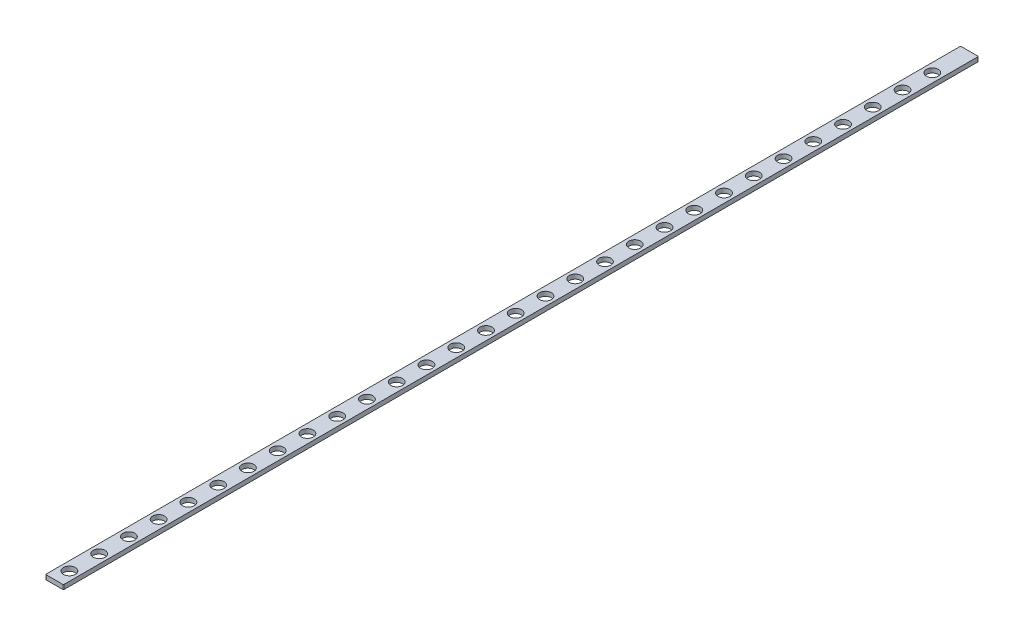
from build123d import *

# Parameters (mm, degrees)
SKETCH_1_W      = 12
SKETCH_1_H      = 615
SKETCH_1_R      = 4
EXTRUDE_1_DEPTH = 3
FILLET_1_R      = 0.5


with BuildPart() as part:
    # 草图1 → 凸台-拉伸1 (new body)
    with BuildSketch(Plane(origin=(0, 0, 0), x_dir=(1, 0, 0), z_dir=(0, 1, 0))):
        Rectangle(SKETCH_1_W, SKETCH_1_H)
        with Locations(Location((0, -297.5, 0), (0, 0, 270))):
            Circle(SKETCH_1_R, mode=Mode.SUBTRACT)
        with Locations(Location((0, -277.5, 0), (0, 0, 270))):
            Circle(SKETCH_1_R, mode=Mode.SUBTRACT)
        with Locations(Location((0, -257.5, 0), (0, 0, 270))):
            Circle(SKETCH_1_R, mode=Mode.SUBTRACT)
        with Locations(Location((0, -237.5, 0), (0, 0, 270))):
            Circle(SKETCH_1_R, mode=Mode.SUBTRACT)
        with Locations(Location((0, -217.5, 0), (0, 0, 270))):
            Circle(SKETCH_1_R, mode=Mode.SUBTRACT)
        with Locations(Location((0, -197.5, 0), (0, 0, 270))):
            Circle(SKETCH_1_R, mode=Mode.SUBTRACT)
        with Locations(Location((0, -177.5, 0), (0, 0, 270))):
            Circle(SKETCH_1_R, mode=Mode.SUBTRACT)
        with Locations(Location((0, -157.5, 0), (0, 0, 270))):
            Circle(SKETCH_1_R, mode=Mode.SUBTRACT)
        with Locations(Location((0, -137.5, 0), (0, 0, 270))):
            Circle(SKETCH_1_R, mode=Mode.SUBTRACT)
        with Locations(Location((0, -117.5, 0), (0, 0, 270))):
            Circle(SKETCH_1_R, mode=Mode.SUBTRACT)
        with Locations(Location((0, -97.5, 0), (0, 0, 270))):
            Circle(SKETCH_1_R, mode=Mode.SUBTRACT)
        with Locations(Location((0, -77.5, 0), (0, 0, 270))):
            Circle(SKETCH_1_R, mode=Mode.SUBTRACT)
        with Locations(Location((0, -57.5, 0), (0, 0, 270))):
            Circle(SKETCH_1_R, mode=Mode.SUBTRACT)
        with Locations(Location((0, -37.5, 0), (0, 0, 270))):
            Circle(SKETCH_1_R, mode=Mode.SUBTRACT)
        with Locations(Location((0, -17.5, 0), (0, 0, 270))):
            Circle(SKETCH_1_R, mode=Mode.SUBTRACT)
        with Locations(Location((0, 2.5, 0), (0, 0, 270))):
            Circle(SKETCH_1_R, mode=Mode.SUBTRACT)
        with Locations(Location((0, 22.5, 0), (0, 0, 270))):
            Circle(SKETCH_1_R, mode=Mode.SUBTRACT)
        with Locations(Location((0, 42.5, 0), (0, 0, 270))):
            Circle(SKETCH_1_R, mode=Mode.SUBTRACT)
        with Locations(Location((0, 62.5, 0), (0, 0, 270))):
            Circle(SKETCH_1_R, mode=Mode.SUBTRACT)
        with Locations(Location((0, 82.5, 0), (0, 0, 270))):
            Circle(SKETCH_1_R, mode=Mode.SUBTRACT)
        with Locations(Location((0, 102.5, 0), (0, 0, 270))):
            Circle(SKETCH_1_R, mode=Mode.SUBTRACT)
        with Locations(Location((0, 122.5, 0), (0, 0, 270))):
            Circle(SKETCH_1_R, mode=Mode.SUBTRACT)
        with Locations(Location((0, 142.5, 0), (0, 0, 270))):
            Circle(SKETCH_1_R, mode=Mode.SUBTRACT)
        with Locations(Location((0, 162.5, 0), (0, 0, 270))):
            Circle(SKETCH_1_R, mode=Mode.SUBTRACT)
        with Locations(Location((0, 182.5, 0), (0, 0, 270))):
            Circle(SKETCH_1_R, mode=Mode.SUBTRACT)
        with Locations(Location((0, 202.5, 0), (0, 0, 270))):
            Circle(SKETCH_1_R, mode=Mode.SUBTRACT)
        with Locations(Location((0, 222.5, 0), (0, 0, 270))):
            Circle(SKETCH_1_R, mode=Mode.SUBTRACT)
        with Locations(Location((0, 242.5, 0), (0, 0, 270))):
            Circle(SKETCH_1_R, mode=Mode.SUBTRACT)
        with Locations(Location((0, 262.5, 0), (0, 0, 270))):
            Circle(SKETCH_1_R, mode=Mode.SUBTRACT)
        with Locations(Location((0, 282.5, 0), (0, 0, 270))):
            Circle(SKETCH_1_R, mode=Mode.SUBTRACT)
    extrude(amount=EXTRUDE_1_DEPTH)

    # 圆角1
    fillet_1_edges = [part.edges().sort_by_distance(p)[0] for p in [
        (6, 1.5, 307.5),
        (-6, 1.5, 307.5),
        (-6, 1.5, -307.5),
        (6, 1.5, -307.5),
    ]]
    fillet(fillet_1_edges, radius=FILLET_1_R)


solid = part.part
